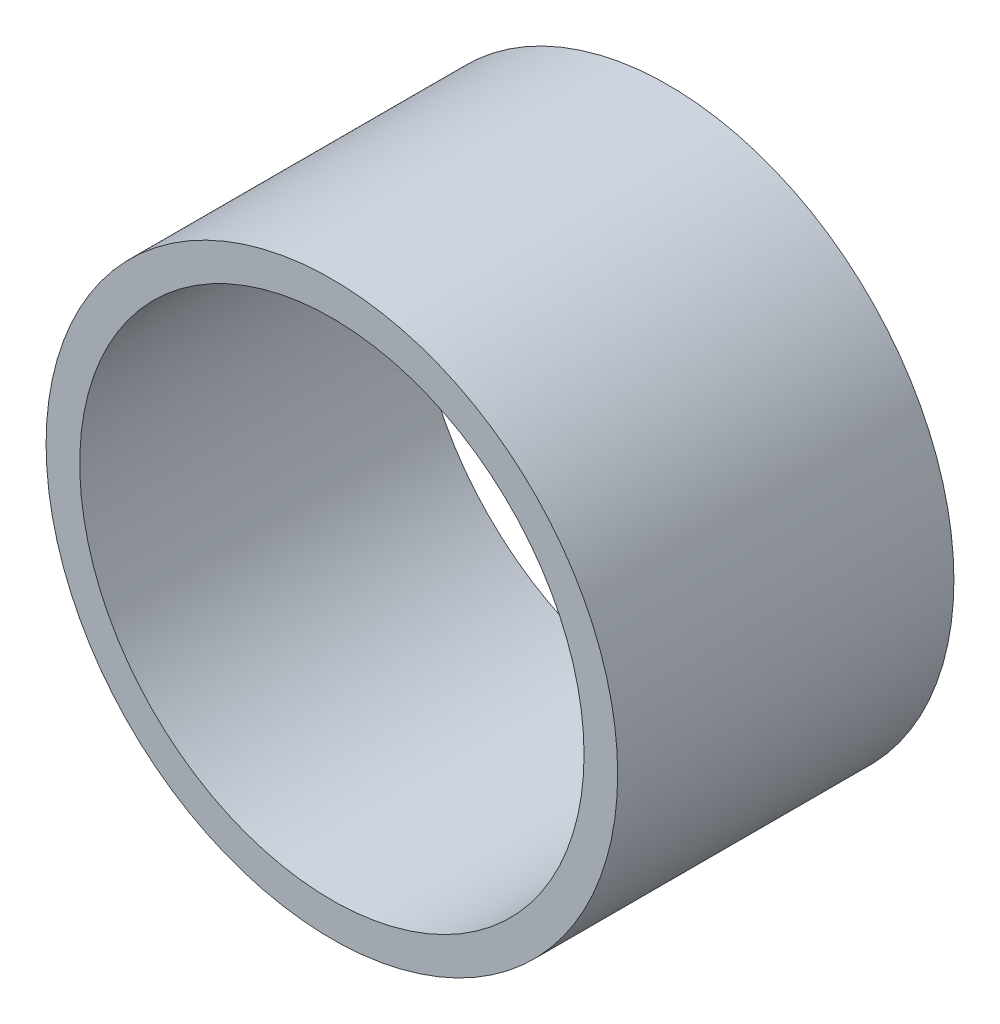
from build123d import *

# Parameters (mm, degrees)
SKETCH_1_R      = 8.5
SKETCH_1_R_2    = 7.5
EXTRUDE_1_DEPTH = 10


with BuildPart() as part:
    # 草图1 → 凸台-拉伸1 (new body)
    with BuildSketch(Plane.XY):
        Circle(SKETCH_1_R)
        Circle(SKETCH_1_R_2, mode=Mode.SUBTRACT)
    extrude(amount=EXTRUDE_1_DEPTH)


solid = part.part
